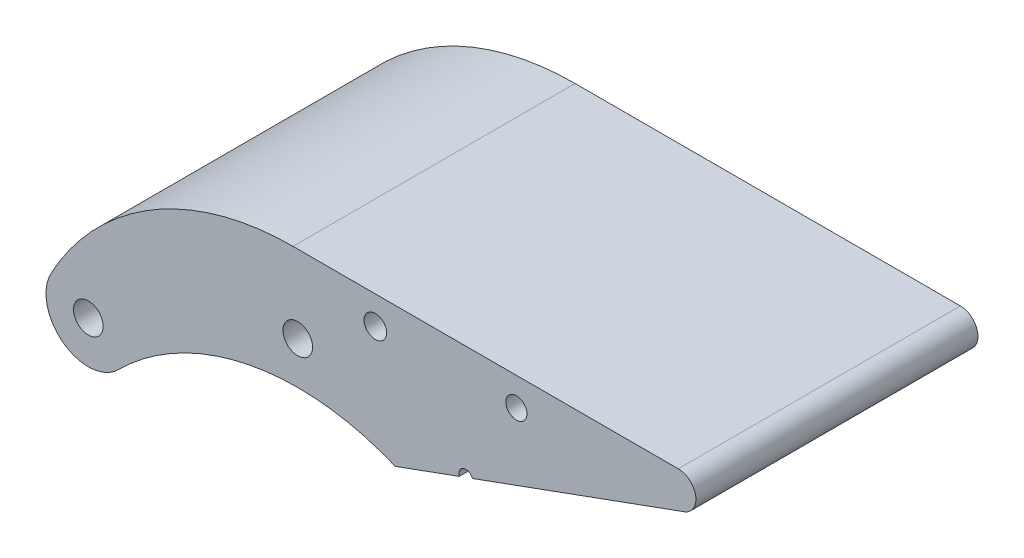
from build123d import *

# Parameters (mm, degrees)
SKETCH_1_R          = 2.1
SKETCH_1_R_2        = 6
EXTRUDE_1_DEPTH     = 40
FILLET_1_R          = 2.5
CUT_EXTRUDE_START   = -40
SKETCH_3_R          = 1.6
SKETCH_3_R_2        = 1.5
SKETCH_3_R_3        = 2.1
CUT_EXTRUDE_2_DEPTH = 40
CUT_EXTRUDE_3_REACH = 89.157
SKETCH_4_R          = 1


with BuildPart() as part:
    # 草图1 → 凸台-拉伸1 (new body)
    # profile 1 of 3: a face of its own
    with BuildSketch(Plane.XY):
        with BuildLine():
            Line((68.135486627, 53), (-0.671642545, 53))
            ThreePointArc((-0.671642545, 53), (15.918389352, 49.295479077), (29.356722765, 38.885684233))
            Line((29.356722765, 38.885684233), (68.135486627, 53))
        make_face()
    # profile 2 of 3: a face of its own
    with BuildSketch(Plane.XY):
        with BuildLine():
            ThreePointArc((29.356722765, 38.885684233), (15.918389352, 49.295479077), (-0.671642545, 53))
            ThreePointArc((-0.671642545, 53), (-20.639649059, 47.500428563), (-34.976092597, 32.552754602))
            ThreePointArc((-34.976092597, 32.552754602), (-28.226351446, 35.515083761), (-23.69848481, 29.69848481))
            ThreePointArc((-23.69848481, 29.69848481), (-24.155207625, 27.402384191), (-25.45584416, 25.455844085))
            ThreePointArc((-25.45584416, 25.455844085), (-6.992802508, 35.314313148), (13.833943007, 33.235854448))
            Line((13.833943007, 33.235854448), (29.356722765, 38.885684233))
        make_face()
        with Locations((0, 42)):
            Circle(SKETCH_1_R, mode=Mode.SUBTRACT)
    # profile 3 of 3: a face of its own
    with BuildSketch(Plane.XY):
        with Locations((-29.69848481, 29.69848481)):
            Circle(SKETCH_1_R_2)
        with Locations((-29.69848481, 29.69848481)):
            Circle(SKETCH_1_R, mode=Mode.SUBTRACT)
    extrude(amount=EXTRUDE_1_DEPTH)

    # 圆角1
    fillet_1_edges = [part.edges().sort_by_distance(p)[0] for p in [
        (68.135486627, 53, 20),
    ]]
    fillet(fillet_1_edges, radius=FILLET_1_R)

    # 草图3 → 切除-拉伸2 (cut)
    with BuildSketch(Plane.XY.offset(40).offset(CUT_EXTRUDE_START)):
        with Locations((11, 49)):
            Circle(SKETCH_3_R)
        with Locations((31, 49)):
            Circle(SKETCH_3_R_2)
        with Locations((0, 42)):
            Circle(SKETCH_3_R_3)
    extrude(amount=CUT_EXTRUDE_2_DEPTH, mode=Mode.SUBTRACT)

    # 草图4 → 切除-拉伸3 (cut, up to next)
    with BuildSketch(Plane.XY.offset(40), mode=Mode.PRIVATE) as cut_extrude_3_sk1:
        with Locations((23.833943007, 36.87555679)):
            Circle(SKETCH_4_R)
    cut_extrude_3_tool1 = extrude(cut_extrude_3_sk1.sketch, amount=-CUT_EXTRUDE_3_REACH, mode=Mode.PRIVATE) & part.part
    add(cut_extrude_3_tool1.solids().sort_by_distance((23.833943, 36.875557, 40))[0], mode=Mode.SUBTRACT)


solid = part.part
